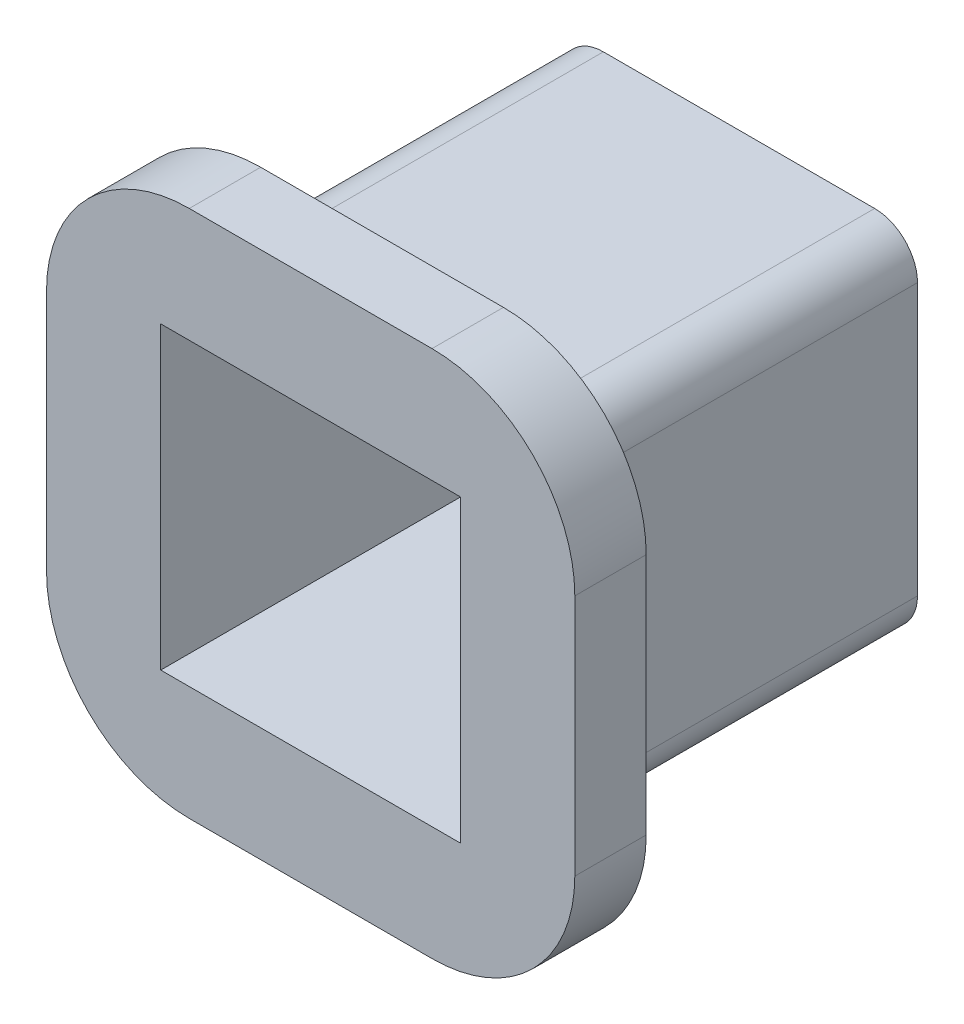
from build123d import *

# Parameters (mm, degrees)
ESQUISSE1_W        = 25
ESQUISSE1_H        = 25
ESQUISSE1_W_2      = 21
ESQUISSE1_H_2      = 21
BOSS_EXTRU_1_DEPTH = 30
ESQUISSE2_W        = 37
ESQUISSE2_H        = 37
ESQUISSE2_W_2      = 25
ESQUISSE2_H_2      = 25
BOSS_EXTRU_2_DEPTH = 5
CONG_1_R           = 10
CONG_2_R           = 3


with BuildPart() as part:
    # Esquisse1 → Boss.-Extru.1 (new body)
    with BuildSketch(Plane.XY):
        Rectangle(ESQUISSE1_W, ESQUISSE1_H)
        Rectangle(ESQUISSE1_W_2, ESQUISSE1_H_2, mode=Mode.SUBTRACT)
    extrude(amount=BOSS_EXTRU_1_DEPTH)

    # Esquisse2 → Boss.-Extru.2 (add)
    with BuildSketch(Plane.XY.offset(30)):
        Rectangle(ESQUISSE2_W, ESQUISSE2_H)
        Rectangle(ESQUISSE2_W_2, ESQUISSE2_H_2, mode=Mode.SUBTRACT)
    extrude(amount=-BOSS_EXTRU_2_DEPTH)

    # Congé1
    cong_1_edges = [part.edges().sort_by_distance(p)[0] for p in [
        (18.5, -18.5, 27.5),
        (-18.5, -18.5, 27.5),
        (-18.5, 18.5, 27.5),
        (18.5, 18.5, 27.5),
    ]]
    fillet(cong_1_edges, radius=CONG_1_R)

    # Congé2
    cong_2_edges = [part.edges().sort_by_distance(p)[0] for p in [
        (12.5, -12.5, 12.5),
        (-12.5, -12.5, 12.5),
        (-12.5, 12.5, 12.5),
        (12.5, 12.5, 12.5),
    ]]
    fillet(cong_2_edges, radius=CONG_2_R)


solid = part.part
